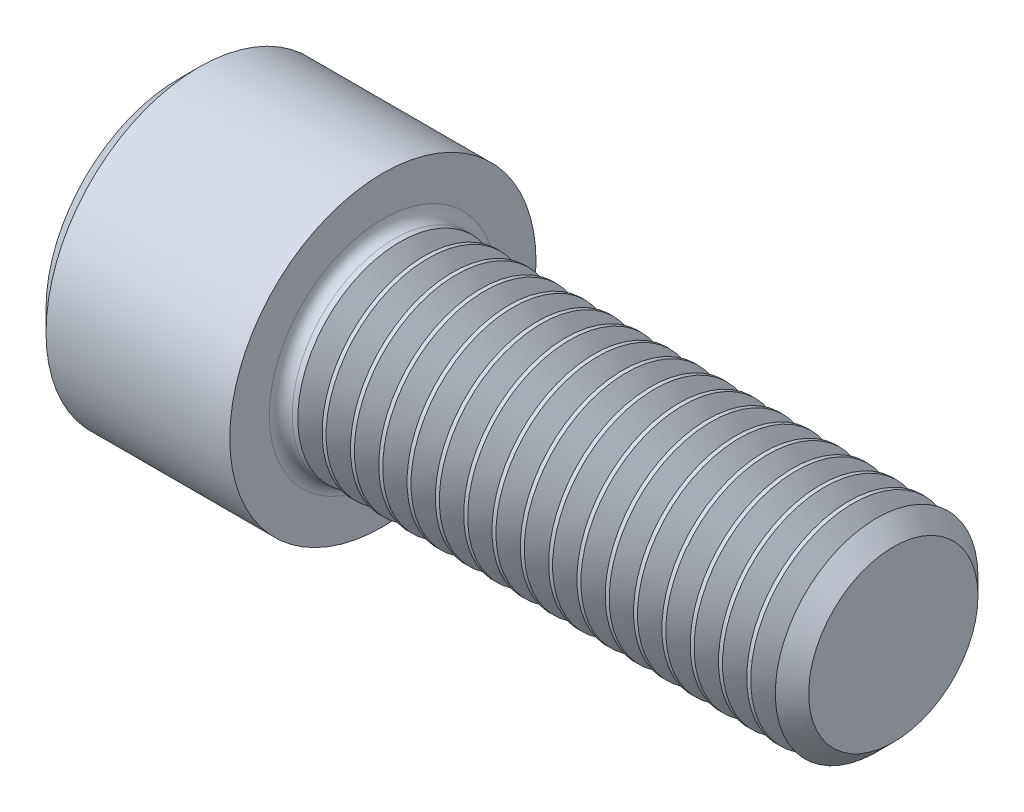
from build123d import *

# Parameters (mm, degrees)
SKETCH1_W            = 6.35
SKETCH1_H            = 4.7625
SKETCH2_R            = 3.175
BOSS_EXTRUDE1_DEPTH  = 0.527953718
SKETCH3_R            = 3.175
BOSS_EXTRUDE2_DEPTH  = 0.378826282
BOSS_EXTRUDE2_TAPER  = 55.000000001
SKETCH4_R            = 2.63398
BOSS_EXTRUDE3_DEPTH  = 0.378826282
BOSS_EXTRUDE3_DRAFT  = -54.999999998
SKETCH5_R            = 3.175
BOSS_EXTRUDE4_DEPTH  = 0.122830965
SKETCH6_R            = 3.175
BOSS_EXTRUDE5_DEPTH  = 0.378826282
BOSS_EXTRUDE5_TAPER  = 54.999999998
SKETCH7_R            = 2.63398
BOSS_EXTRUDE6_DEPTH  = 0.378826282
BOSS_EXTRUDE6_DRAFT  = -54.999999998
SKETCH8_R            = 3.175
BOSS_EXTRUDE7_DEPTH  = 0.122830965
SKETCH9_R            = 3.175
BOSS_EXTRUDE8_DEPTH  = 0.378826282
BOSS_EXTRUDE8_TAPER  = 54.999999998
SKETCH10_R           = 2.63398
BOSS_EXTRUDE9_DEPTH  = 0.378826282
BOSS_EXTRUDE9_DRAFT  = -54.999999998
SKETCH11_R           = 3.175
BOSS_EXTRUDE10_DEPTH = 0.122830965
SKETCH12_R           = 3.175
BOSS_EXTRUDE11_DEPTH = 0.378826282
BOSS_EXTRUDE11_TAPER = 54.999999998
SKETCH13_R           = 2.63398
BOSS_EXTRUDE12_DEPTH = 0.378826282
BOSS_EXTRUDE12_DRAFT = -54.999999998
SKETCH14_R           = 3.175
BOSS_EXTRUDE13_DEPTH = 0.122830965
SKETCH15_R           = 3.175
BOSS_EXTRUDE14_DEPTH = 0.378826282
BOSS_EXTRUDE14_TAPER = 54.999999998
SKETCH16_R           = 2.63398
BOSS_EXTRUDE15_DEPTH = 0.378826282
BOSS_EXTRUDE15_DRAFT = -54.999999998
SKETCH17_R           = 3.175
BOSS_EXTRUDE16_DEPTH = 0.122830965
SKETCH18_R           = 3.175
BOSS_EXTRUDE17_DEPTH = 0.378826282
BOSS_EXTRUDE17_TAPER = 54.999999998
SKETCH19_R           = 2.63398
BOSS_EXTRUDE18_DEPTH = 0.378826282
BOSS_EXTRUDE18_DRAFT = -54.999999998
SKETCH20_R           = 3.175
BOSS_EXTRUDE19_DEPTH = 0.122830965
SKETCH21_R           = 3.175
BOSS_EXTRUDE20_DEPTH = 0.378826282
BOSS_EXTRUDE20_TAPER = 54.999999998
SKETCH22_R           = 2.63398
BOSS_EXTRUDE21_DEPTH = 0.378826282
BOSS_EXTRUDE21_DRAFT = -54.999999998
SKETCH23_R           = 3.175
BOSS_EXTRUDE22_DEPTH = 0.122830965
SKETCH24_R           = 3.175
BOSS_EXTRUDE23_DEPTH = 0.378826282
BOSS_EXTRUDE23_TAPER = 54.999999998
SKETCH25_R           = 2.63398
BOSS_EXTRUDE24_DEPTH = 0.378826282
BOSS_EXTRUDE24_DRAFT = -54.999999998
SKETCH26_R           = 3.175
BOSS_EXTRUDE25_DEPTH = 0.122830965
SKETCH27_R           = 3.175
BOSS_EXTRUDE26_DEPTH = 0.378826282
BOSS_EXTRUDE26_TAPER = 55
SKETCH28_R           = 2.63398
BOSS_EXTRUDE27_DEPTH = 0.378826282
BOSS_EXTRUDE27_DRAFT = -54.999999998
SKETCH29_R           = 3.175
BOSS_EXTRUDE28_DEPTH = 0.122830965
SKETCH30_R           = 3.175
BOSS_EXTRUDE29_DEPTH = 0.378826282
BOSS_EXTRUDE29_TAPER = 54.999999998
SKETCH31_R           = 2.63398
BOSS_EXTRUDE30_DEPTH = 0.378826282
BOSS_EXTRUDE30_DRAFT = -54.999999998
SKETCH32_R           = 3.175
BOSS_EXTRUDE31_DEPTH = 0.122830965
SKETCH33_R           = 3.175
BOSS_EXTRUDE32_DEPTH = 0.378826282
BOSS_EXTRUDE32_TAPER = 55
SKETCH34_R           = 2.63398
BOSS_EXTRUDE33_DEPTH = 0.378826282
BOSS_EXTRUDE33_DRAFT = -54.999999998
SKETCH35_R           = 3.175
BOSS_EXTRUDE34_DEPTH = 0.122830965
SKETCH36_R           = 3.175
BOSS_EXTRUDE35_DEPTH = 0.378826282
BOSS_EXTRUDE35_TAPER = 55
SKETCH37_R           = 2.63398
BOSS_EXTRUDE36_DEPTH = 0.378826282
BOSS_EXTRUDE36_DRAFT = -54.999999998
SKETCH38_R           = 3.175
BOSS_EXTRUDE37_DEPTH = 0.122830965
SKETCH39_R           = 3.175
BOSS_EXTRUDE38_DEPTH = 0.378826282
BOSS_EXTRUDE38_TAPER = 55
SKETCH40_R           = 2.63398
BOSS_EXTRUDE39_DEPTH = 0.378826282
BOSS_EXTRUDE39_DRAFT = -54.999999998
SKETCH41_R           = 3.175
BOSS_EXTRUDE40_DEPTH = 0.122830965
SKETCH42_R           = 3.175
BOSS_EXTRUDE41_DEPTH = 0.378826282
BOSS_EXTRUDE41_TAPER = 55
SKETCH43_R           = 2.63398
BOSS_EXTRUDE42_DEPTH = 0.378826282
BOSS_EXTRUDE42_DRAFT = -54.999999998
SKETCH44_R           = 3.175
BOSS_EXTRUDE43_DEPTH = 0.122830965
SKETCH45_R           = 3.175
BOSS_EXTRUDE44_DEPTH = 0.378826282
BOSS_EXTRUDE44_TAPER = 55
SKETCH46_R           = 2.63398
BOSS_EXTRUDE45_DEPTH = 0.378826282
BOSS_EXTRUDE45_DRAFT = -54.999999998
SKETCH47_R           = 3.175
BOSS_EXTRUDE46_DEPTH = 0.122830965
SKETCH48_R           = 3.175
BOSS_EXTRUDE47_DEPTH = 0.378826282
BOSS_EXTRUDE47_TAPER = 55
SKETCH49_R           = 2.63398
BOSS_EXTRUDE48_DEPTH = 0.378826282
BOSS_EXTRUDE48_DRAFT = -54.999999998
SKETCH50_R           = 3.175
BOSS_EXTRUDE49_DEPTH = 0.122830965
SKETCH51_R           = 3.175
BOSS_EXTRUDE50_DEPTH = 0.378826282
BOSS_EXTRUDE50_TAPER = 55
SKETCH52_R           = 2.63398
BOSS_EXTRUDE51_DEPTH = 0.362615264
BOSS_EXTRUDE51_DRAFT = -54.999999997
SKETCH53_R           = 3.151848266
BOSS_EXTRUDE52_DEPTH = 0.517868266
BOSS_EXTRUDE52_TAPER = 45.000000003
CUT_EXTRUDE1_DEPTH   = 3.048
CHAMFER1_SIZE        = 0.635
FILLET1_R            = 0.3556


with BuildPart() as part:
    # Sketch1 → Revolve1 (revolve)
    with BuildSketch(Plane(origin=(0, 0, 0), x_dir=(-1, 0, 0), z_dir=(0, 0, -1)), mode=Mode.PRIVATE) as revolve1_sk:
        with Locations((-3.175, 2.38125)):
            Rectangle(SKETCH1_W, SKETCH1_H)
    revolve(revolve1_sk.sketch.rotate(Axis((6.35, 0, 0), (-1, 0, 0)), 270), axis=Axis((6.35, 0, 0), (-1, 0, 0)))

    # Sketch2 → Boss-Extrude1 (add)
    with BuildSketch(Plane(origin=(6.35, 0, 0), x_dir=(0, 0, -1), z_dir=(1, 0, 0))):
        Circle(SKETCH2_R)
    extrude(amount=BOSS_EXTRUDE1_DEPTH)

    # Sketch3 → Boss-Extrude2 (add)
    with BuildSketch(Plane(origin=(6.877953718, 0, 0), x_dir=(0, 0, -1), z_dir=(1, 0, 0))):
        Circle(SKETCH3_R)
    extrude(amount=BOSS_EXTRUDE2_DEPTH, taper=BOSS_EXTRUDE2_TAPER)


with BuildPart() as boss_extrude3_tool:
    # Sketch4 → Boss-Extrude3 (with draft: the straight prism first)
    with BuildSketch(Plane(origin=(7.25678, 0, 0), x_dir=(0, 0, -1), z_dir=(1, 0, 0))):
        Circle(SKETCH4_R)
    extrude(amount=BOSS_EXTRUDE3_DEPTH)
    # Boss-Extrude3: the draft: its side faces are tilted about the plane it starts from
    boss_extrude3_sides = [boss_extrude3_tool.faces().sort_by_distance(p)[0] for p in [
        (7.446193141, 0, 2.63398),
    ]]
    draft(boss_extrude3_sides, Plane(origin=(7.25678, 0, 0), x_dir=(0, 0, -1), z_dir=(1, 0, 0)), BOSS_EXTRUDE3_DRAFT)


with BuildPart() as part_1:
    add(part.part)

    # Boss-Extrude3: add boss_extrude3_tool
    add(boss_extrude3_tool.part)

    # Sketch5 → Boss-Extrude4 (add)
    with BuildSketch(Plane(origin=(7.635606282, 0, 0), x_dir=(0, 0, -1), z_dir=(1, 0, 0))):
        Circle(SKETCH5_R)
    extrude(amount=BOSS_EXTRUDE4_DEPTH)

    # Sketch6 → Boss-Extrude5 (add)
    with BuildSketch(Plane(origin=(7.758437247, 0, 0), x_dir=(0, 0, -1), z_dir=(1, 0, 0))):
        Circle(SKETCH6_R)
    extrude(amount=BOSS_EXTRUDE5_DEPTH, taper=BOSS_EXTRUDE5_TAPER)


with BuildPart() as boss_extrude6_tool:
    # Sketch7 → Boss-Extrude6 (with draft: the straight prism first)
    with BuildSketch(Plane(origin=(8.137263529, 0, 0), x_dir=(0, 0, -1), z_dir=(1, 0, 0))):
        Circle(SKETCH7_R)
    extrude(amount=BOSS_EXTRUDE6_DEPTH)
    # Boss-Extrude6: the draft: its side faces are tilted about the plane it starts from
    boss_extrude6_sides = [boss_extrude6_tool.faces().sort_by_distance(p)[0] for p in [
        (8.326676671, 0, 2.63398),
    ]]
    draft(boss_extrude6_sides, Plane(origin=(8.137263529, 0, 0), x_dir=(0, 0, -1), z_dir=(1, 0, 0)), BOSS_EXTRUDE6_DRAFT)


with BuildPart() as part_2:
    add(part_1.part)

    # Boss-Extrude6: add boss_extrude6_tool
    add(boss_extrude6_tool.part)

    # Sketch8 → Boss-Extrude7 (add)
    with BuildSketch(Plane(origin=(8.516089812, 0, 0), x_dir=(0, 0, -1), z_dir=(1, 0, 0))):
        Circle(SKETCH8_R)
    extrude(amount=BOSS_EXTRUDE7_DEPTH)

    # Sketch9 → Boss-Extrude8 (add)
    with BuildSketch(Plane(origin=(8.638920777, 0, 0), x_dir=(0, 0, -1), z_dir=(1, 0, 0))):
        Circle(SKETCH9_R)
    extrude(amount=BOSS_EXTRUDE8_DEPTH, taper=BOSS_EXTRUDE8_TAPER)


with BuildPart() as boss_extrude9_tool:
    # Sketch10 → Boss-Extrude9 (with draft: the straight prism first)
    with BuildSketch(Plane(origin=(9.017747059, 0, 0), x_dir=(0, 0, -1), z_dir=(1, 0, 0))):
        Circle(SKETCH10_R)
    extrude(amount=BOSS_EXTRUDE9_DEPTH)
    # Boss-Extrude9: the draft: its side faces are tilted about the plane it starts from
    boss_extrude9_sides = [boss_extrude9_tool.faces().sort_by_distance(p)[0] for p in [
        (9.2071602, 0, 2.63398),
    ]]
    draft(boss_extrude9_sides, Plane(origin=(9.017747059, 0, 0), x_dir=(0, 0, -1), z_dir=(1, 0, 0)), BOSS_EXTRUDE9_DRAFT)


with BuildPart() as part_3:
    add(part_2.part)

    # Boss-Extrude9: add boss_extrude9_tool
    add(boss_extrude9_tool.part)

    # Sketch11 → Boss-Extrude10 (add)
    with BuildSketch(Plane(origin=(9.396573341, 0, 0), x_dir=(0, 0, -1), z_dir=(1, 0, 0))):
        Circle(SKETCH11_R)
    extrude(amount=BOSS_EXTRUDE10_DEPTH)

    # Sketch12 → Boss-Extrude11 (add)
    with BuildSketch(Plane(origin=(9.519404306, 0, 0), x_dir=(0, 0, -1), z_dir=(1, 0, 0))):
        Circle(SKETCH12_R)
    extrude(amount=BOSS_EXTRUDE11_DEPTH, taper=BOSS_EXTRUDE11_TAPER)


with BuildPart() as boss_extrude12_tool:
    # Sketch13 → Boss-Extrude12 (with draft: the straight prism first)
    with BuildSketch(Plane(origin=(9.898230588, 0, 0), x_dir=(0, 0, -1), z_dir=(1, 0, 0))):
        Circle(SKETCH13_R)
    extrude(amount=BOSS_EXTRUDE12_DEPTH)
    # Boss-Extrude12: the draft: its side faces are tilted about the plane it starts from
    boss_extrude12_sides = [boss_extrude12_tool.faces().sort_by_distance(p)[0] for p in [
        (10.087643729, 0, 2.63398),
    ]]
    draft(boss_extrude12_sides, Plane(origin=(9.898230588, 0, 0), x_dir=(0, 0, -1), z_dir=(1, 0, 0)), BOSS_EXTRUDE12_DRAFT)


with BuildPart() as part_4:
    add(part_3.part)

    # Boss-Extrude12: add boss_extrude12_tool
    add(boss_extrude12_tool.part)

    # Sketch14 → Boss-Extrude13 (add)
    with BuildSketch(Plane(origin=(10.277056871, 0, 0), x_dir=(0, 0, -1), z_dir=(1, 0, 0))):
        Circle(SKETCH14_R)
    extrude(amount=BOSS_EXTRUDE13_DEPTH)

    # Sketch15 → Boss-Extrude14 (add)
    with BuildSketch(Plane(origin=(10.399887835, 0, 0), x_dir=(0, 0, -1), z_dir=(1, 0, 0))):
        Circle(SKETCH15_R)
    extrude(amount=BOSS_EXTRUDE14_DEPTH, taper=BOSS_EXTRUDE14_TAPER)


with BuildPart() as boss_extrude15_tool:
    # Sketch16 → Boss-Extrude15 (with draft: the straight prism first)
    with BuildSketch(Plane(origin=(10.778714118, 0, 0), x_dir=(0, 0, -1), z_dir=(1, 0, 0))):
        Circle(SKETCH16_R)
    extrude(amount=BOSS_EXTRUDE15_DEPTH)
    # Boss-Extrude15: the draft: its side faces are tilted about the plane it starts from
    boss_extrude15_sides = [boss_extrude15_tool.faces().sort_by_distance(p)[0] for p in [
        (10.968127259, 0, 2.63398),
    ]]
    draft(boss_extrude15_sides, Plane(origin=(10.778714118, 0, 0), x_dir=(0, 0, -1), z_dir=(1, 0, 0)), BOSS_EXTRUDE15_DRAFT)


with BuildPart() as part_5:
    add(part_4.part)

    # Boss-Extrude15: add boss_extrude15_tool
    add(boss_extrude15_tool.part)

    # Sketch17 → Boss-Extrude16 (add)
    with BuildSketch(Plane(origin=(11.1575404, 0, 0), x_dir=(0, 0, -1), z_dir=(1, 0, 0))):
        Circle(SKETCH17_R)
    extrude(amount=BOSS_EXTRUDE16_DEPTH)

    # Sketch18 → Boss-Extrude17 (add)
    with BuildSketch(Plane(origin=(11.280371365, 0, 0), x_dir=(0, 0, -1), z_dir=(1, 0, 0))):
        Circle(SKETCH18_R)
    extrude(amount=BOSS_EXTRUDE17_DEPTH, taper=BOSS_EXTRUDE17_TAPER)


with BuildPart() as boss_extrude18_tool:
    # Sketch19 → Boss-Extrude18 (with draft: the straight prism first)
    with BuildSketch(Plane(origin=(11.659197647, 0, 0), x_dir=(0, 0, -1), z_dir=(1, 0, 0))):
        Circle(SKETCH19_R)
    extrude(amount=BOSS_EXTRUDE18_DEPTH)
    # Boss-Extrude18: the draft: its side faces are tilted about the plane it starts from
    boss_extrude18_sides = [boss_extrude18_tool.faces().sort_by_distance(p)[0] for p in [
        (11.848610788, 0, 2.63398),
    ]]
    draft(boss_extrude18_sides, Plane(origin=(11.659197647, 0, 0), x_dir=(0, 0, -1), z_dir=(1, 0, 0)), BOSS_EXTRUDE18_DRAFT)


with BuildPart() as part_6:
    add(part_5.part)

    # Boss-Extrude18: add boss_extrude18_tool
    add(boss_extrude18_tool.part)

    # Sketch20 → Boss-Extrude19 (add)
    with BuildSketch(Plane(origin=(12.038023929, 0, 0), x_dir=(0, 0, -1), z_dir=(1, 0, 0))):
        Circle(SKETCH20_R)
    extrude(amount=BOSS_EXTRUDE19_DEPTH)

    # Sketch21 → Boss-Extrude20 (add)
    with BuildSketch(Plane(origin=(12.160854894, 0, 0), x_dir=(0, 0, -1), z_dir=(1, 0, 0))):
        Circle(SKETCH21_R)
    extrude(amount=BOSS_EXTRUDE20_DEPTH, taper=BOSS_EXTRUDE20_TAPER)


with BuildPart() as boss_extrude21_tool:
    # Sketch22 → Boss-Extrude21 (with draft: the straight prism first)
    with BuildSketch(Plane(origin=(12.539681176, 0, 0), x_dir=(0, 0, -1), z_dir=(1, 0, 0))):
        Circle(SKETCH22_R)
    extrude(amount=BOSS_EXTRUDE21_DEPTH)
    # Boss-Extrude21: the draft: its side faces are tilted about the plane it starts from
    boss_extrude21_sides = [boss_extrude21_tool.faces().sort_by_distance(p)[0] for p in [
        (12.729094318, 0, 2.63398),
    ]]
    draft(boss_extrude21_sides, Plane(origin=(12.539681176, 0, 0), x_dir=(0, 0, -1), z_dir=(1, 0, 0)), BOSS_EXTRUDE21_DRAFT)


with BuildPart() as part_7:
    add(part_6.part)

    # Boss-Extrude21: add boss_extrude21_tool
    add(boss_extrude21_tool.part)

    # Sketch23 → Boss-Extrude22 (add)
    with BuildSketch(Plane(origin=(12.918507459, 0, 0), x_dir=(0, 0, -1), z_dir=(1, 0, 0))):
        Circle(SKETCH23_R)
    extrude(amount=BOSS_EXTRUDE22_DEPTH)

    # Sketch24 → Boss-Extrude23 (add)
    with BuildSketch(Plane(origin=(13.041338424, 0, 0), x_dir=(0, 0, -1), z_dir=(1, 0, 0))):
        Circle(SKETCH24_R)
    extrude(amount=BOSS_EXTRUDE23_DEPTH, taper=BOSS_EXTRUDE23_TAPER)


with BuildPart() as boss_extrude24_tool:
    # Sketch25 → Boss-Extrude24 (with draft: the straight prism first)
    with BuildSketch(Plane(origin=(13.420164706, 0, 0), x_dir=(0, 0, -1), z_dir=(1, 0, 0))):
        Circle(SKETCH25_R)
    extrude(amount=BOSS_EXTRUDE24_DEPTH)
    # Boss-Extrude24: the draft: its side faces are tilted about the plane it starts from
    boss_extrude24_sides = [boss_extrude24_tool.faces().sort_by_distance(p)[0] for p in [
        (13.609577847, 0, 2.63398),
    ]]
    draft(boss_extrude24_sides, Plane(origin=(13.420164706, 0, 0), x_dir=(0, 0, -1), z_dir=(1, 0, 0)), BOSS_EXTRUDE24_DRAFT)


with BuildPart() as part_8:
    add(part_7.part)

    # Boss-Extrude24: add boss_extrude24_tool
    add(boss_extrude24_tool.part)

    # Sketch26 → Boss-Extrude25 (add)
    with BuildSketch(Plane(origin=(13.798990988, 0, 0), x_dir=(0, 0, -1), z_dir=(1, 0, 0))):
        Circle(SKETCH26_R)
    extrude(amount=BOSS_EXTRUDE25_DEPTH)

    # Sketch27 → Boss-Extrude26 (add)
    with BuildSketch(Plane(origin=(13.921821953, 0, 0), x_dir=(0, 0, -1), z_dir=(1, 0, 0))):
        Circle(SKETCH27_R)
    extrude(amount=BOSS_EXTRUDE26_DEPTH, taper=BOSS_EXTRUDE26_TAPER)


with BuildPart() as boss_extrude27_tool:
    # Sketch28 → Boss-Extrude27 (with draft: the straight prism first)
    with BuildSketch(Plane(origin=(14.300648235, 0, 0), x_dir=(0, 0, -1), z_dir=(1, 0, 0))):
        Circle(SKETCH28_R)
    extrude(amount=BOSS_EXTRUDE27_DEPTH)
    # Boss-Extrude27: the draft: its side faces are tilted about the plane it starts from
    boss_extrude27_sides = [boss_extrude27_tool.faces().sort_by_distance(p)[0] for p in [
        (14.490061376, 0, 2.63398),
    ]]
    draft(boss_extrude27_sides, Plane(origin=(14.300648235, 0, 0), x_dir=(0, 0, -1), z_dir=(1, 0, 0)), BOSS_EXTRUDE27_DRAFT)


with BuildPart() as part_9:
    add(part_8.part)

    # Boss-Extrude27: add boss_extrude27_tool
    add(boss_extrude27_tool.part)

    # Sketch29 → Boss-Extrude28 (add)
    with BuildSketch(Plane(origin=(14.679474518, 0, 0), x_dir=(0, 0, -1), z_dir=(1, 0, 0))):
        Circle(SKETCH29_R)
    extrude(amount=BOSS_EXTRUDE28_DEPTH)

    # Sketch30 → Boss-Extrude29 (add)
    with BuildSketch(Plane(origin=(14.802305482, 0, 0), x_dir=(0, 0, -1), z_dir=(1, 0, 0))):
        Circle(SKETCH30_R)
    extrude(amount=BOSS_EXTRUDE29_DEPTH, taper=BOSS_EXTRUDE29_TAPER)


with BuildPart() as boss_extrude30_tool:
    # Sketch31 → Boss-Extrude30 (with draft: the straight prism first)
    with BuildSketch(Plane(origin=(15.181131765, 0, 0), x_dir=(0, 0, -1), z_dir=(1, 0, 0))):
        Circle(SKETCH31_R)
    extrude(amount=BOSS_EXTRUDE30_DEPTH)
    # Boss-Extrude30: the draft: its side faces are tilted about the plane it starts from
    boss_extrude30_sides = [boss_extrude30_tool.faces().sort_by_distance(p)[0] for p in [
        (15.370544906, 0, 2.63398),
    ]]
    draft(boss_extrude30_sides, Plane(origin=(15.181131765, 0, 0), x_dir=(0, 0, -1), z_dir=(1, 0, 0)), BOSS_EXTRUDE30_DRAFT)


with BuildPart() as part_10:
    add(part_9.part)

    # Boss-Extrude30: add boss_extrude30_tool
    add(boss_extrude30_tool.part)

    # Sketch32 → Boss-Extrude31 (add)
    with BuildSketch(Plane(origin=(15.559958047, 0, 0), x_dir=(0, 0, -1), z_dir=(1, 0, 0))):
        Circle(SKETCH32_R)
    extrude(amount=BOSS_EXTRUDE31_DEPTH)

    # Sketch33 → Boss-Extrude32 (add)
    with BuildSketch(Plane(origin=(15.682789012, 0, 0), x_dir=(0, 0, -1), z_dir=(1, 0, 0))):
        Circle(SKETCH33_R)
    extrude(amount=BOSS_EXTRUDE32_DEPTH, taper=BOSS_EXTRUDE32_TAPER)


with BuildPart() as boss_extrude33_tool:
    # Sketch34 → Boss-Extrude33 (with draft: the straight prism first)
    with BuildSketch(Plane(origin=(16.061615294, 0, 0), x_dir=(0, 0, -1), z_dir=(1, 0, 0))):
        Circle(SKETCH34_R)
    extrude(amount=BOSS_EXTRUDE33_DEPTH)
    # Boss-Extrude33: the draft: its side faces are tilted about the plane it starts from
    boss_extrude33_sides = [boss_extrude33_tool.faces().sort_by_distance(p)[0] for p in [
        (16.251028435, 0, 2.63398),
    ]]
    draft(boss_extrude33_sides, Plane(origin=(16.061615294, 0, 0), x_dir=(0, 0, -1), z_dir=(1, 0, 0)), BOSS_EXTRUDE33_DRAFT)


with BuildPart() as part_11:
    add(part_10.part)

    # Boss-Extrude33: add boss_extrude33_tool
    add(boss_extrude33_tool.part)

    # Sketch35 → Boss-Extrude34 (add)
    with BuildSketch(Plane(origin=(16.440441576, 0, 0), x_dir=(0, 0, -1), z_dir=(1, 0, 0))):
        Circle(SKETCH35_R)
    extrude(amount=BOSS_EXTRUDE34_DEPTH)

    # Sketch36 → Boss-Extrude35 (add)
    with BuildSketch(Plane(origin=(16.563272541, 0, 0), x_dir=(0, 0, -1), z_dir=(1, 0, 0))):
        Circle(SKETCH36_R)
    extrude(amount=BOSS_EXTRUDE35_DEPTH, taper=BOSS_EXTRUDE35_TAPER)


with BuildPart() as boss_extrude36_tool:
    # Sketch37 → Boss-Extrude36 (with draft: the straight prism first)
    with BuildSketch(Plane(origin=(16.942098824, 0, 0), x_dir=(0, 0, -1), z_dir=(1, 0, 0))):
        Circle(SKETCH37_R)
    extrude(amount=BOSS_EXTRUDE36_DEPTH)
    # Boss-Extrude36: the draft: its side faces are tilted about the plane it starts from
    boss_extrude36_sides = [boss_extrude36_tool.faces().sort_by_distance(p)[0] for p in [
        (17.131511965, 0, 2.63398),
    ]]
    draft(boss_extrude36_sides, Plane(origin=(16.942098824, 0, 0), x_dir=(0, 0, -1), z_dir=(1, 0, 0)), BOSS_EXTRUDE36_DRAFT)


with BuildPart() as part_12:
    add(part_11.part)

    # Boss-Extrude36: add boss_extrude36_tool
    add(boss_extrude36_tool.part)

    # Sketch38 → Boss-Extrude37 (add)
    with BuildSketch(Plane(origin=(17.320925106, 0, 0), x_dir=(0, 0, -1), z_dir=(1, 0, 0))):
        Circle(SKETCH38_R)
    extrude(amount=BOSS_EXTRUDE37_DEPTH)

    # Sketch39 → Boss-Extrude38 (add)
    with BuildSketch(Plane(origin=(17.443756071, 0, 0), x_dir=(0, 0, -1), z_dir=(1, 0, 0))):
        Circle(SKETCH39_R)
    extrude(amount=BOSS_EXTRUDE38_DEPTH, taper=BOSS_EXTRUDE38_TAPER)


with BuildPart() as boss_extrude39_tool:
    # Sketch40 → Boss-Extrude39 (with draft: the straight prism first)
    with BuildSketch(Plane(origin=(17.822582353, 0, 0), x_dir=(0, 0, -1), z_dir=(1, 0, 0))):
        Circle(SKETCH40_R)
    extrude(amount=BOSS_EXTRUDE39_DEPTH)
    # Boss-Extrude39: the draft: its side faces are tilted about the plane it starts from
    boss_extrude39_sides = [boss_extrude39_tool.faces().sort_by_distance(p)[0] for p in [
        (18.011995494, 0, 2.63398),
    ]]
    draft(boss_extrude39_sides, Plane(origin=(17.822582353, 0, 0), x_dir=(0, 0, -1), z_dir=(1, 0, 0)), BOSS_EXTRUDE39_DRAFT)


with BuildPart() as part_13:
    add(part_12.part)

    # Boss-Extrude39: add boss_extrude39_tool
    add(boss_extrude39_tool.part)

    # Sketch41 → Boss-Extrude40 (add)
    with BuildSketch(Plane(origin=(18.201408635, 0, 0), x_dir=(0, 0, -1), z_dir=(1, 0, 0))):
        Circle(SKETCH41_R)
    extrude(amount=BOSS_EXTRUDE40_DEPTH)

    # Sketch42 → Boss-Extrude41 (add)
    with BuildSketch(Plane(origin=(18.3242396, 0, 0), x_dir=(0, 0, -1), z_dir=(1, 0, 0))):
        Circle(SKETCH42_R)
    extrude(amount=BOSS_EXTRUDE41_DEPTH, taper=BOSS_EXTRUDE41_TAPER)


with BuildPart() as boss_extrude42_tool:
    # Sketch43 → Boss-Extrude42 (with draft: the straight prism first)
    with BuildSketch(Plane(origin=(18.703065882, 0, 0), x_dir=(0, 0, -1), z_dir=(1, 0, 0))):
        Circle(SKETCH43_R)
    extrude(amount=BOSS_EXTRUDE42_DEPTH)
    # Boss-Extrude42: the draft: its side faces are tilted about the plane it starts from
    boss_extrude42_sides = [boss_extrude42_tool.faces().sort_by_distance(p)[0] for p in [
        (18.892479023, 0, 2.63398),
    ]]
    draft(boss_extrude42_sides, Plane(origin=(18.703065882, 0, 0), x_dir=(0, 0, -1), z_dir=(1, 0, 0)), BOSS_EXTRUDE42_DRAFT)


with BuildPart() as part_14:
    add(part_13.part)

    # Boss-Extrude42: add boss_extrude42_tool
    add(boss_extrude42_tool.part)

    # Sketch44 → Boss-Extrude43 (add)
    with BuildSketch(Plane(origin=(19.081892165, 0, 0), x_dir=(0, 0, -1), z_dir=(1, 0, 0))):
        Circle(SKETCH44_R)
    extrude(amount=BOSS_EXTRUDE43_DEPTH)

    # Sketch45 → Boss-Extrude44 (add)
    with BuildSketch(Plane(origin=(19.204723129, 0, 0), x_dir=(0, 0, -1), z_dir=(1, 0, 0))):
        Circle(SKETCH45_R)
    extrude(amount=BOSS_EXTRUDE44_DEPTH, taper=BOSS_EXTRUDE44_TAPER)


with BuildPart() as boss_extrude45_tool:
    # Sketch46 → Boss-Extrude45 (with draft: the straight prism first)
    with BuildSketch(Plane(origin=(19.583549412, 0, 0), x_dir=(0, 0, -1), z_dir=(1, 0, 0))):
        Circle(SKETCH46_R)
    extrude(amount=BOSS_EXTRUDE45_DEPTH)
    # Boss-Extrude45: the draft: its side faces are tilted about the plane it starts from
    boss_extrude45_sides = [boss_extrude45_tool.faces().sort_by_distance(p)[0] for p in [
        (19.772962553, 0, 2.63398),
    ]]
    draft(boss_extrude45_sides, Plane(origin=(19.583549412, 0, 0), x_dir=(0, 0, -1), z_dir=(1, 0, 0)), BOSS_EXTRUDE45_DRAFT)


with BuildPart() as part_15:
    add(part_14.part)

    # Boss-Extrude45: add boss_extrude45_tool
    add(boss_extrude45_tool.part)

    # Sketch47 → Boss-Extrude46 (add)
    with BuildSketch(Plane(origin=(19.962375694, 0, 0), x_dir=(0, 0, -1), z_dir=(1, 0, 0))):
        Circle(SKETCH47_R)
    extrude(amount=BOSS_EXTRUDE46_DEPTH)

    # Sketch48 → Boss-Extrude47 (add)
    with BuildSketch(Plane(origin=(20.085206659, 0, 0), x_dir=(0, 0, -1), z_dir=(1, 0, 0))):
        Circle(SKETCH48_R)
    extrude(amount=BOSS_EXTRUDE47_DEPTH, taper=BOSS_EXTRUDE47_TAPER)


with BuildPart() as boss_extrude48_tool:
    # Sketch49 → Boss-Extrude48 (with draft: the straight prism first)
    with BuildSketch(Plane(origin=(20.464032941, 0, 0), x_dir=(0, 0, -1), z_dir=(1, 0, 0))):
        Circle(SKETCH49_R)
    extrude(amount=BOSS_EXTRUDE48_DEPTH)
    # Boss-Extrude48: the draft: its side faces are tilted about the plane it starts from
    boss_extrude48_sides = [boss_extrude48_tool.faces().sort_by_distance(p)[0] for p in [
        (20.653446082, 0, 2.63398),
    ]]
    draft(boss_extrude48_sides, Plane(origin=(20.464032941, 0, 0), x_dir=(0, 0, -1), z_dir=(1, 0, 0)), BOSS_EXTRUDE48_DRAFT)


with BuildPart() as part_16:
    add(part_15.part)

    # Boss-Extrude48: add boss_extrude48_tool
    add(boss_extrude48_tool.part)

    # Sketch50 → Boss-Extrude49 (add)
    with BuildSketch(Plane(origin=(20.842859223, 0, 0), x_dir=(0, 0, -1), z_dir=(1, 0, 0))):
        Circle(SKETCH50_R)
    extrude(amount=BOSS_EXTRUDE49_DEPTH)

    # Sketch51 → Boss-Extrude50 (add)
    with BuildSketch(Plane(origin=(20.965690188, 0, 0), x_dir=(0, 0, -1), z_dir=(1, 0, 0))):
        Circle(SKETCH51_R)
    extrude(amount=BOSS_EXTRUDE50_DEPTH, taper=BOSS_EXTRUDE50_TAPER)


with BuildPart() as boss_extrude51_tool:
    # Sketch52 → Boss-Extrude51 (with draft: the straight prism first)
    with BuildSketch(Plane(origin=(21.344516471, 0, 0), x_dir=(0, 0, -1), z_dir=(1, 0, 0))):
        Circle(SKETCH52_R)
    extrude(amount=BOSS_EXTRUDE51_DEPTH)
    # Boss-Extrude51: the draft: its side faces are tilted about the plane it starts from
    boss_extrude51_sides = [boss_extrude51_tool.faces().sort_by_distance(p)[0] for p in [
        (21.525824102, 0, 2.63398),
    ]]
    draft(boss_extrude51_sides, Plane(origin=(21.344516471, 0, 0), x_dir=(0, 0, -1), z_dir=(1, 0, 0)), BOSS_EXTRUDE51_DRAFT)


with BuildPart() as part_17:
    add(part_16.part)

    # Boss-Extrude51: add boss_extrude51_tool
    add(boss_extrude51_tool.part)

    # Sketch53 → Boss-Extrude52 (add)
    with BuildSketch(Plane(origin=(21.707131734, 0, 0), x_dir=(0, 0, -1), z_dir=(1, 0, 0))):
        Circle(SKETCH53_R)
    extrude(amount=BOSS_EXTRUDE52_DEPTH, taper=BOSS_EXTRUDE52_TAPER)

    # Sketch54 → Cut-Extrude1 (cut)
    with BuildSketch(Plane.ZY):
        Polygon((-2.38125, -1.374815329), (0, -2.749630657), (2.38125, -1.374815329), (2.38125, 1.374815329), (0, 2.749630657), (-2.38125, 1.374815329), align=None)
    extrude(amount=-CUT_EXTRUDE1_DEPTH, mode=Mode.SUBTRACT)

    # Sketch55 → Cut-Revolve1 (revolve, cut)
    with BuildSketch(Plane.XY, mode=Mode.PRIVATE) as cut_revolve1_sk:
        Polygon((3.048, 2.38125), (3.048, 0), (4.422815329, 0), align=None)
    revolve(cut_revolve1_sk.sketch.rotate(Axis((3.047975, 0, 0), (1, 0, 0)), 90), axis=Axis((3.047975, 0, 0), (1, 0, 0)), mode=Mode.SUBTRACT)

    # Chamfer1
    chamfer1_edges = [part_17.edges().sort_by_distance(p)[0] for p in [
        (0, 0, -4.7625),
    ]]
    chamfer(chamfer1_edges, length=CHAMFER1_SIZE)

    # Fillet1
    fillet1_edges = [part_17.edges().sort_by_distance(p)[0] for p in [
        (6.35, 0, 3.175),
    ]]
    fillet(fillet1_edges, radius=FILLET1_R)


solid = part_17.part
